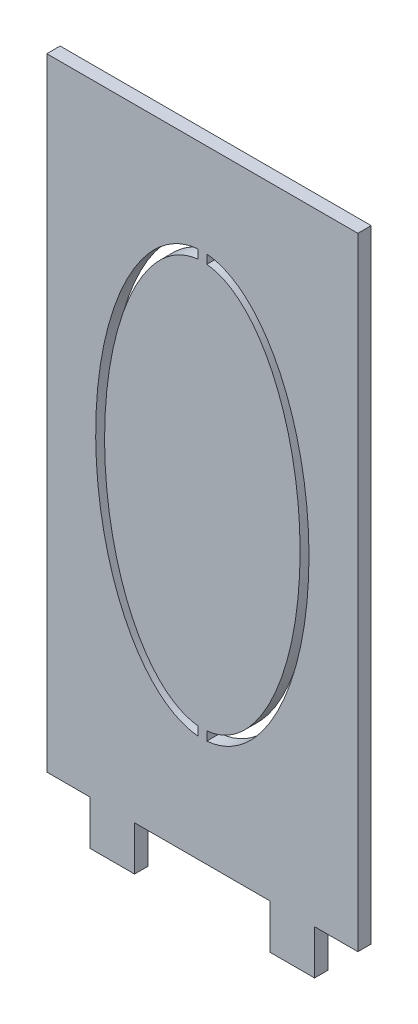
from build123d import *

# Parameters (mm, degrees)
SKIZZE1_W                        = 35
SKIZZE1_H                        = 75
AUFSATZ_LINEAR_AUSTRAGEN1_DEPTH  = 1.5
SKIZZE3_W                        = 15.25
SKIZZE3_H                        = 5
SKIZZE3_W_2                      = 4.875
SCHNITT_LINEAR_AUSTRAGEN12_DEPTH = 20
SKIZZE4_RX                       = 23.75
SKIZZE4_RY                       = 12
SKIZZE4_RX_2                     = 22.75
SKIZZE4_RY_2                     = 11
SCHNITT_LINEAR_AUSTRAGEN13_DEPTH = 20
SKIZZE6_W                        = 1
SKIZZE6_H                        = 52.800334248
AUFSATZ_LINEAR_AUSTRAGEN4_DEPTH  = 1.5


with BuildPart() as part:
    # Skizze1 → Aufsatz-Linear austragen1 (new body)
    with BuildSketch(Plane.XY):
        with Locations((17.5, 37.5)):
            Rectangle(SKIZZE1_W, SKIZZE1_H)
    extrude(amount=AUFSATZ_LINEAR_AUSTRAGEN1_DEPTH)

    # Skizze3 → Schnitt-Linear austragen12 (cut)
    with BuildSketch(Plane.XY.offset(1.5)):
        with Locations((17.5, 2.5)):
            Rectangle(SKIZZE3_W, SKIZZE3_H)
        with Locations((32.5625, 2.5)):
            Rectangle(SKIZZE3_W_2, SKIZZE3_H)
        with Locations((2.4375, 2.5)):
            Rectangle(SKIZZE3_W_2, SKIZZE3_H)
    extrude(amount=-SCHNITT_LINEAR_AUSTRAGEN12_DEPTH, mode=Mode.SUBTRACT)

    # Skizze4 → Schnitt-Linear austragen13 (cut)
    with BuildSketch(Plane.XY.offset(1.5)):
        with Locations(Location((17.5, 40.75), (0, 0, 90))):
            Ellipse(SKIZZE4_RX, SKIZZE4_RY)
        with Locations(Location((17.5, 40.75), (0, 0, 90))):
            Ellipse(SKIZZE4_RX_2, SKIZZE4_RY_2, mode=Mode.SUBTRACT)
    extrude(amount=-SCHNITT_LINEAR_AUSTRAGEN13_DEPTH, mode=Mode.SUBTRACT)


with BuildPart() as schnitt_linear_austragen13_piece_1:
    # of the separate pieces the step leaves, piece 1, a body of its own (schnitt_linear_austragen13_pieces)
    add(part.part.solids().sort_by_distance((4.875, 0, 0))[0])



with BuildPart() as schnitt_linear_austragen13_piece_2:
    # of the separate pieces the step leaves, piece 2, a body of its own (schnitt_linear_austragen13_pieces)
    add(part.part.solids().sort_by_distance((17.5, 63.5, 0))[0])


with BuildPart() as schnitt_linear_austragen13_piece_1_1:
    add(schnitt_linear_austragen13_piece_1.part)

    add(schnitt_linear_austragen13_piece_2.part)  # Aufsatz-Linear austragen4 merges Schnitt-Linear austragen13 piece 2
    # Skizze6 → Aufsatz-Linear austragen4 (add)
    with BuildSketch(Plane.XY.offset(1.5)):
        with Locations((17.5, 39.413172243)):
            Rectangle(SKIZZE6_W, SKIZZE6_H)
    extrude(amount=-AUFSATZ_LINEAR_AUSTRAGEN4_DEPTH)


solid = schnitt_linear_austragen13_piece_1_1.part
